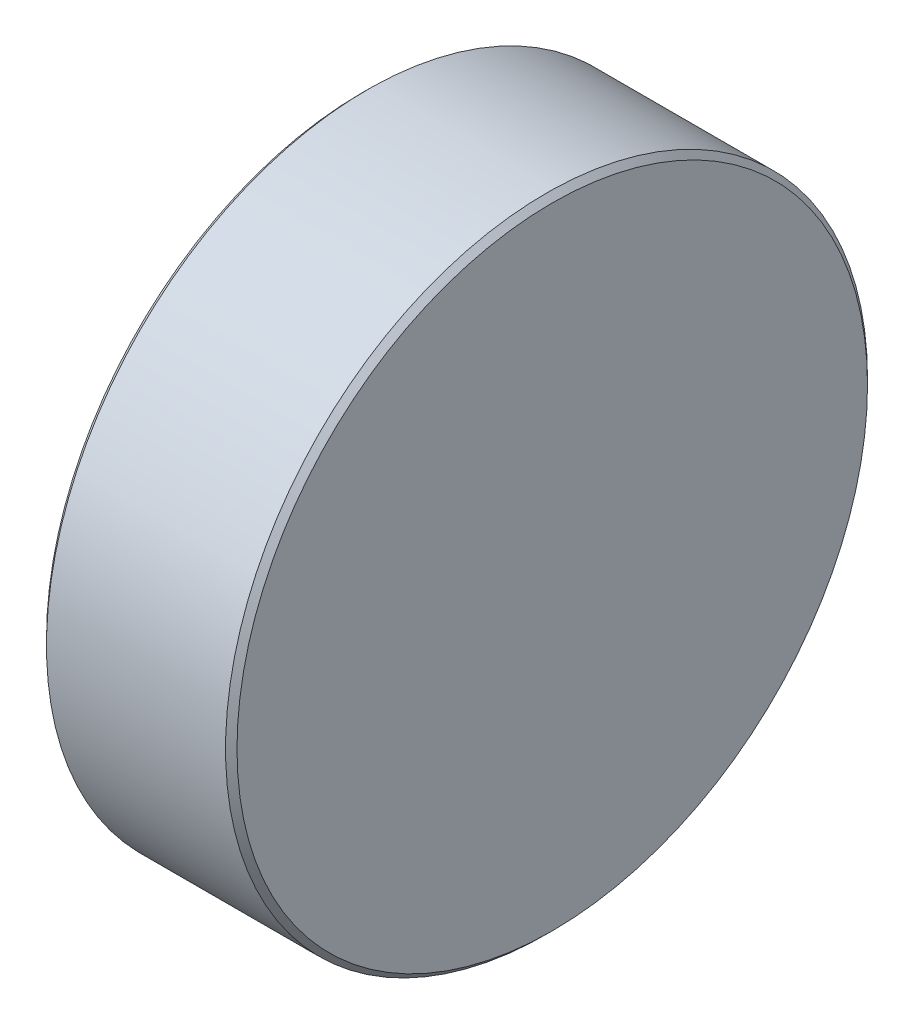
from build123d import *

# Parameters (mm, degrees)
SKETCH_1_R        = 16.85
EXTRUDE_1_DEPTH   = 10
CHAMFER_C0_3_SIZE = 0.3


with BuildPart() as part:
    # 草图1 → 凸台-拉伸1 (new body)
    with BuildSketch(Plane(origin=(0, 0, 0), x_dir=(0, 0, -1), z_dir=(1, 0, 0))):
        Circle(SKETCH_1_R)
    extrude(amount=EXTRUDE_1_DEPTH)

    # 圆盘外缘倒角_C0.3
    chamfer_c0_3_edges = [part.edges().sort_by_distance(p)[0] for p in [
        (0, 0, 16.85),
        (10, 0, 16.85),
    ]]
    chamfer(chamfer_c0_3_edges, length=CHAMFER_C0_3_SIZE)


solid = part.part
